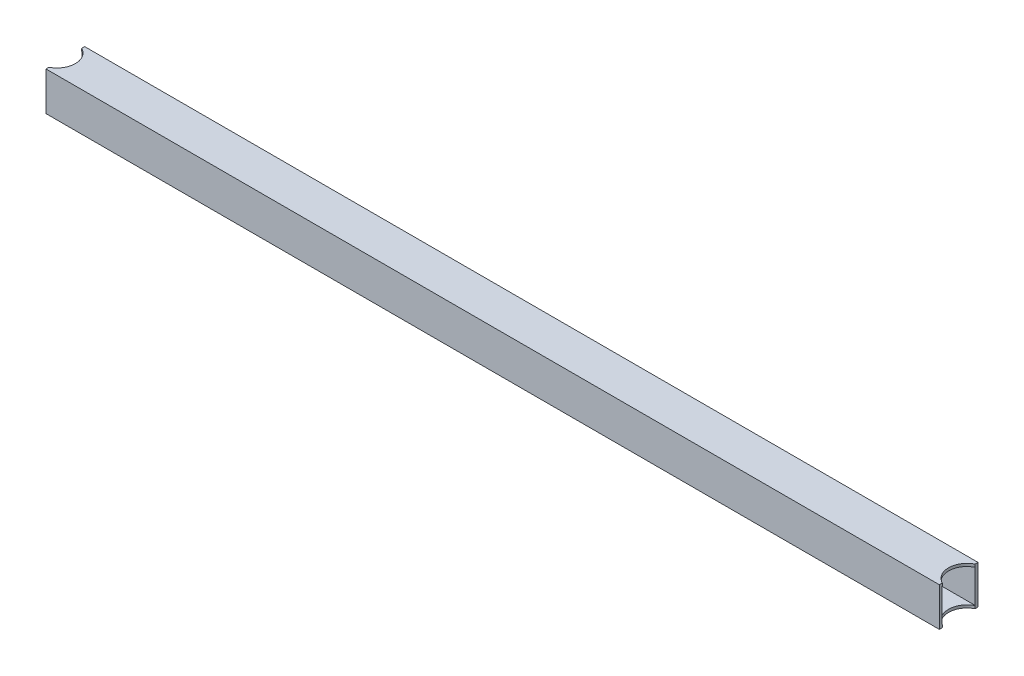
from build123d import *

# Parameters (mm, degrees)
BOSS_EXTRUDE1_DEPTH = 44.45
SKETCH3_W           = 38.1
SKETCH3_H           = 38.1
CUT_EXTRUDE1_DEPTH  = 1028.362690935


with BuildPart() as part:
    # Sketch2 → Boss-Extrude1 (new body)
    with BuildSketch(Plane(origin=(0, 0, 0), x_dir=(1, 0, 0), z_dir=(0, 1, 0))):
        with BuildLine():
            Line((513.08, 18.807580892), (513.08, 22.225))
            Line((513.08, 22.225), (-513.08, 22.225))
            Line((-513.08, 22.225), (-513.08, 18.807580892))
            ThreePointArc((-513.08, 18.807580892), (-504.64314077, 11.037315661), (-501.523, 0))
            ThreePointArc((-501.523, 0), (-504.64314077, -11.037315661), (-513.08, -18.807580892))
            Line((-513.08, -18.807580892), (-513.08, -22.225))
            Line((-513.08, -22.225), (513.08, -22.225))
            Line((513.08, -22.225), (513.08, -18.807580892))
            ThreePointArc((513.08, -18.807580892), (501.523, 0), (513.08, 18.807580892))
        make_face()
    extrude(amount=BOSS_EXTRUDE1_DEPTH)

    # Sketch3 → Cut-Extrude1 (cut, through all)
    with BuildSketch(Plane.ZY.offset(513.08)):
        with Locations((0, 22.225)):
            Rectangle(SKETCH3_W, SKETCH3_H)
    extrude(amount=-CUT_EXTRUDE1_DEPTH, mode=Mode.SUBTRACT)


solid = part.part
